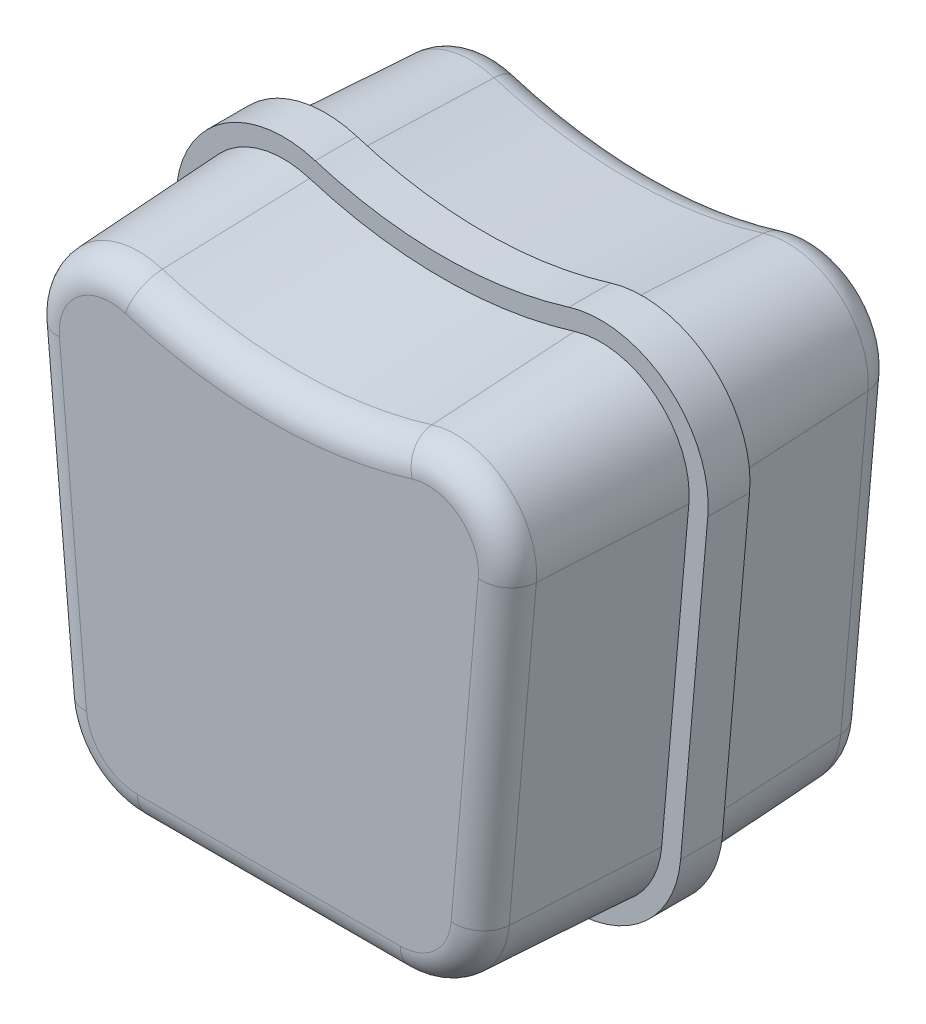
from build123d import *

# Parameters (mm, degrees)
BOSS_EXTRUDE1_DEPTH           = 32.5
BOSS_EXTRUDE1_TAPER           = 3.0000000000000067
BOSS_EXTRUDE1_OTHER_WAY_DEPTH = 32.5
BOSS_EXTRUDE1_OTHER_WAY_TAPER = 3.0000000000000067
FILLET1_R                     = 5
EXTRUDE_THIN1_DEPTH           = 3.5


with BuildPart() as part:
    # Sketch1 → Boss-Extrude1 (new body)
    with BuildSketch(Plane(origin=(0, 0, 0), x_dir=(0, 1, 0), z_dir=(0, 0, 1))):
        with BuildLine():
            ThreePointArc((-39, -22), (-35.05916005215183, -32.13385311423494), (-25.307336141214776, -36.94292047137618))
            Line((-25.307336141214776, -36.94292047137618), (26.697869727868188, -41.49278642925244))
            ThreePointArc((26.697869727868188, -41.49278642925244), (39.67535451570329, -35.97364601503939), (42.33767155756914, -22.124888298230207))
            ThreePointArc((42.33767155756914, -22.124888298230207), (39, 9.18e-15), (42.33767155756914, 22.124888298230207))
            ThreePointArc((42.33767155756914, 22.124888298230207), (39.67535451570329, 35.97364601503939), (26.697869727868188, 41.49278642925244))
            Line((26.697869727868188, 41.49278642925244), (-25.307336141214776, 36.94292047137618))
            ThreePointArc((-25.307336141214776, 36.94292047137618), (-35.059160052151825, 32.13385311423494), (-39, 22))
            Line((-39, 22), (-39, -22))
        make_face()
    extrude(amount=BOSS_EXTRUDE1_DEPTH, taper=BOSS_EXTRUDE1_TAPER)

    # Sketch1 → Boss-Extrude1 other way (add)
    with BuildSketch(Plane(origin=(0, 0, 0), x_dir=(0, 1, 0), z_dir=(0, 0, 1))):
        with BuildLine():
            ThreePointArc((-39, -22), (-35.05916005215183, -32.13385311423494), (-25.307336141214776, -36.94292047137618))
            Line((-25.307336141214776, -36.94292047137618), (26.697869727868188, -41.49278642925244))
            ThreePointArc((26.697869727868188, -41.49278642925244), (39.67535451570329, -35.97364601503939), (42.33767155756914, -22.124888298230207))
            ThreePointArc((42.33767155756914, -22.124888298230207), (39, 9.18e-15), (42.33767155756914, 22.124888298230207))
            ThreePointArc((42.33767155756914, 22.124888298230207), (39.67535451570329, 35.97364601503939), (26.697869727868188, 41.49278642925244))
            Line((26.697869727868188, 41.49278642925244), (-25.307336141214776, 36.94292047137618))
            ThreePointArc((-25.307336141214776, 36.94292047137618), (-35.059160052151825, 32.13385311423494), (-39, 22))
            Line((-39, 22), (-39, -22))
        make_face()
    extrude(amount=-BOSS_EXTRUDE1_OTHER_WAY_DEPTH, taper=BOSS_EXTRUDE1_OTHER_WAY_TAPER)

    # Fillet1
    fillet1_edges = [part.edges().sort_by_distance(p)[0] for p in [
        (30.983152183423496, -33.80339034416901, -32.5),
        (37.52108201484714, 0.8437150585246758, -32.5),
        (34.90357401366931, 38.35020693767984, -32.5),
        (6.661e-14, 37.296747173301156, -32.5),
        (-30.9831521834235, -33.80339034416899, 32.50000000000001),
        (5.09e-15, -37.296747173301156, 32.50000000000001),
        (30.983152183423503, -33.80339034416899, 32.50000000000001),
        (37.521082014847224, 0.8437150585246735, 32.500000000000014),
        (34.9035740136693, 38.35020693767984, 32.50000000000001),
        (-34.903574013669285, 38.35020693767984, -32.5),
        (-8.9e-16, 37.29674717330116, 32.50000000000001),
        (-34.9035740136693, 38.35020693767985, 32.50000000000001),
        (-37.52108201484706, 0.8437150585246949, 32.5),
        (-37.521082014847146, 0.8437150585246864, -32.5),
        (-30.983152183423496, -33.803390344168996, -32.5),
        (1.119e-14, -37.296747173301156, -32.5),
    ]]
    fillet(fillet1_edges, radius=FILLET1_R)

    # Sketch1<2> → Extrude-Thin1 (add, symmetric)
    with BuildSketch(Plane(origin=(0, 0, 0), x_dir=(0, 1, 0), z_dir=(0, 0, 1))):
        with BuildLine():
            Line((-42, -22), (-42, 22))
            ThreePointArc((-42, 21.999999999999996), (-37.270992062582195, 34.160623737081934), (-25.56880336945773, 39.93150456565142))
            Line((-25.56880336945773, 39.93150456565142), (26.436402499625235, 44.48137052352768))
            ThreePointArc((26.436402499625235, 44.48137052352768), (42.009384245027356, 37.858402026472014), (45.20416469526637, 21.239892766301))
            ThreePointArc((45.20416469526637, 21.239892766300997), (42, 8.82e-15), (45.20416469526637, -21.239892766300997))
            ThreePointArc((45.20416469526637, -21.239892766301), (42.009384245027356, -37.858402026472014), (26.436402499625235, -44.48137052352768))
            Line((26.436402499625235, -44.48137052352768), (-25.56880336945773, -39.93150456565142))
            ThreePointArc((-25.568803369457736, -39.931504565651416), (-37.270992062582195, -34.16062373708193), (-42, -22.000000000000004))
        make_face()
        with BuildLine():
            Line((-36, -22), (-36, 22))
            ThreePointArc((-36, 22.000000000000004), (-32.84732804172147, 30.107082491387963), (-25.045868912971823, 33.95433637710095))
            Line((-25.045868912971823, 33.954336377100944), (26.95933695611114, 38.5042023349772))
            ThreePointArc((26.95933695611114, 38.5042023349772), (37.341324786379225, 34.08889000360676), (39.471178419871904, 23.009883830159414))
            ThreePointArc((39.471178419871904, 23.009883830159417), (36, 9.55e-15), (39.471178419871904, -23.009883830159417))
            ThreePointArc((39.471178419871904, -23.009883830159414), (37.341324786379225, -34.08889000360676), (26.95933695611114, -38.5042023349772))
            Line((26.95933695611114, -38.5042023349772), (-25.045868912971823, -33.954336377100944))
            ThreePointArc((-25.045868912971816, -33.95433637710095), (-32.84732804172146, -30.107082491387953), (-36, -21.999999999999996))
        make_face(mode=Mode.SUBTRACT)
    extrude(amount=EXTRUDE_THIN1_DEPTH, both=True)


solid = part.part
